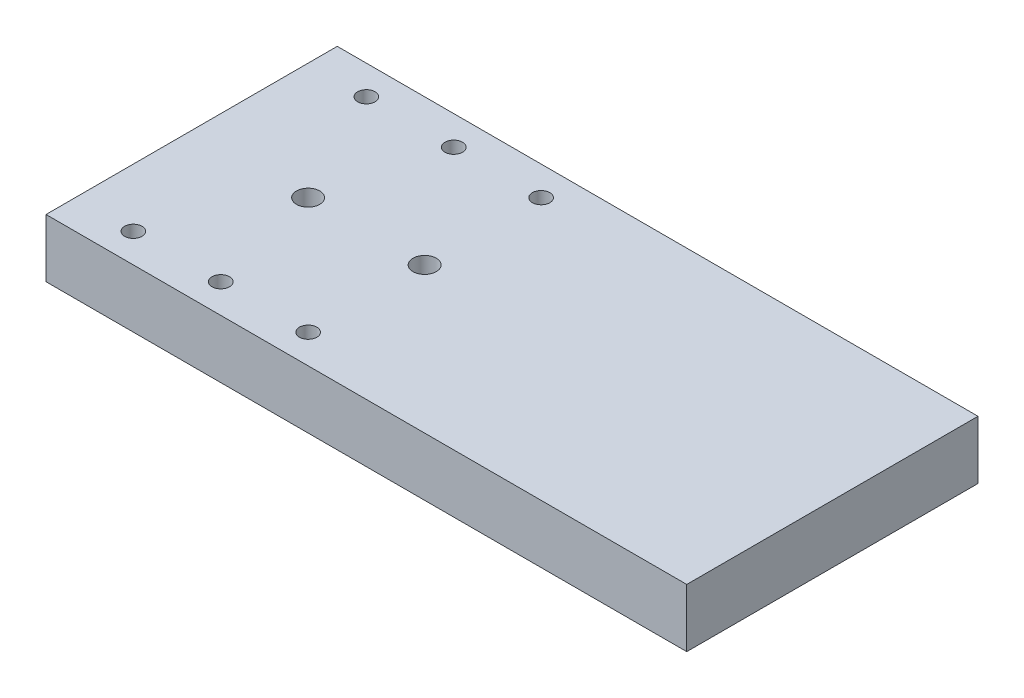
from build123d import *

# Parameters (mm, degrees)
SKETCH_1_W          = 220
SKETCH_1_H          = 100
EXTRUDE_1_DEPTH     = 20
SKETCH_2_R          = 4
CUT_EXTRUDE_1_DEPTH = 10
SKETCH_3_R          = 3
CUT_EXTRUDE_2_DEPTH = 20


with BuildPart() as part:
    # Эскиз1 → Бобышка-Вытянуть1 (new body)
    with BuildSketch(Plane(origin=(0, 0, 0), x_dir=(1, 0, 0), z_dir=(0, 1, 0))):
        with Locations((110, 50)):
            Rectangle(SKETCH_1_W, SKETCH_1_H)
    extrude(amount=EXTRUDE_1_DEPTH)

    # Эскиз2 → Вырез-Вытянуть1 (cut)
    with BuildSketch(Plane(origin=(0, 20, 0), x_dir=(1, 0, 0), z_dir=(0, 1, 0))):
        with Locations(Location((80, 50, 0), (0, 0, 270))):
            Circle(SKETCH_2_R)
        with Locations(Location((40, 50, 0), (0, 0, 270))):
            Circle(SKETCH_2_R)
    extrude(amount=-CUT_EXTRUDE_1_DEPTH, mode=Mode.SUBTRACT)

    # Эскиз3 → Вырез-Вытянуть2 (cut)
    with BuildSketch(Plane(origin=(0, 20, 0), x_dir=(1, 0, 0), z_dir=(0, 1, 0))):
        with Locations(Location((20, 90, 0), (0, 0, 270))):
            Circle(SKETCH_3_R)
        with Locations(Location((50, 90, 0), (0, 0, 270))):
            Circle(SKETCH_3_R)
        with Locations(Location((80, 90, 0), (0, 0, 270))):
            Circle(SKETCH_3_R)
        with Locations(Location((20, 10, 0), (0, 0, 270))):
            Circle(SKETCH_3_R)
        with Locations(Location((50, 10, 0), (0, 0, 270))):
            Circle(SKETCH_3_R)
        with Locations(Location((80, 10, 0), (0, 0, 270))):
            Circle(SKETCH_3_R)
    extrude(amount=-CUT_EXTRUDE_2_DEPTH, mode=Mode.SUBTRACT)


solid = part.part
